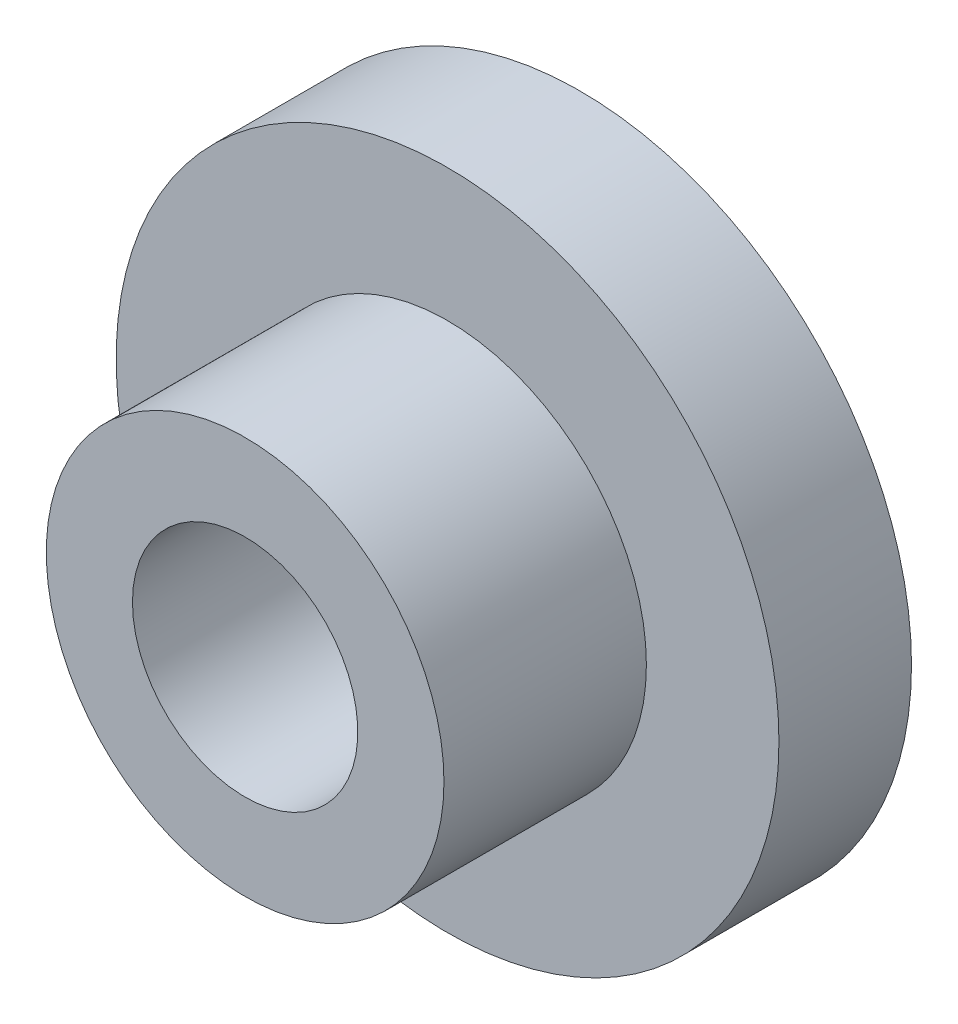
from build123d import *

# Parameters (mm, degrees)
SKETCH_1_R        = 3
EXTRUDE_2_DEPTH   = 5
SKETCH_3_R        = 5
EXTRUDE_3_DEPTH   = 2
HOLE_WIZARD_M31_D = 3.4


with BuildPart() as part:
    # Эскиз1 → Бобышка-Вытянуть2 (new body)
    with BuildSketch(Plane.XY):
        with Locations((-15.5, 15.5)):
            Circle(SKETCH_1_R)
    extrude(amount=EXTRUDE_2_DEPTH)

    # Эскиз3 → Бобышка-Вытянуть3 (add)
    with BuildSketch(Plane.XY.offset(-0.053912026)):
        with Locations((-15.5, 15.5)):
            Circle(SKETCH_3_R)
    extrude(amount=EXTRUDE_3_DEPTH)

    # Отверстие с зазором M31 (through all)
    with Locations(Plane(origin=(-3.782161831, -3.025449216, -0.053912026), x_dir=(-0.9755899156330161, 0.2196003563639286, 0), z_dir=(0, 0, -1))):
        with Locations((15.5, 15.5)):
            Hole(HOLE_WIZARD_M31_D / 2)


solid = part.part
